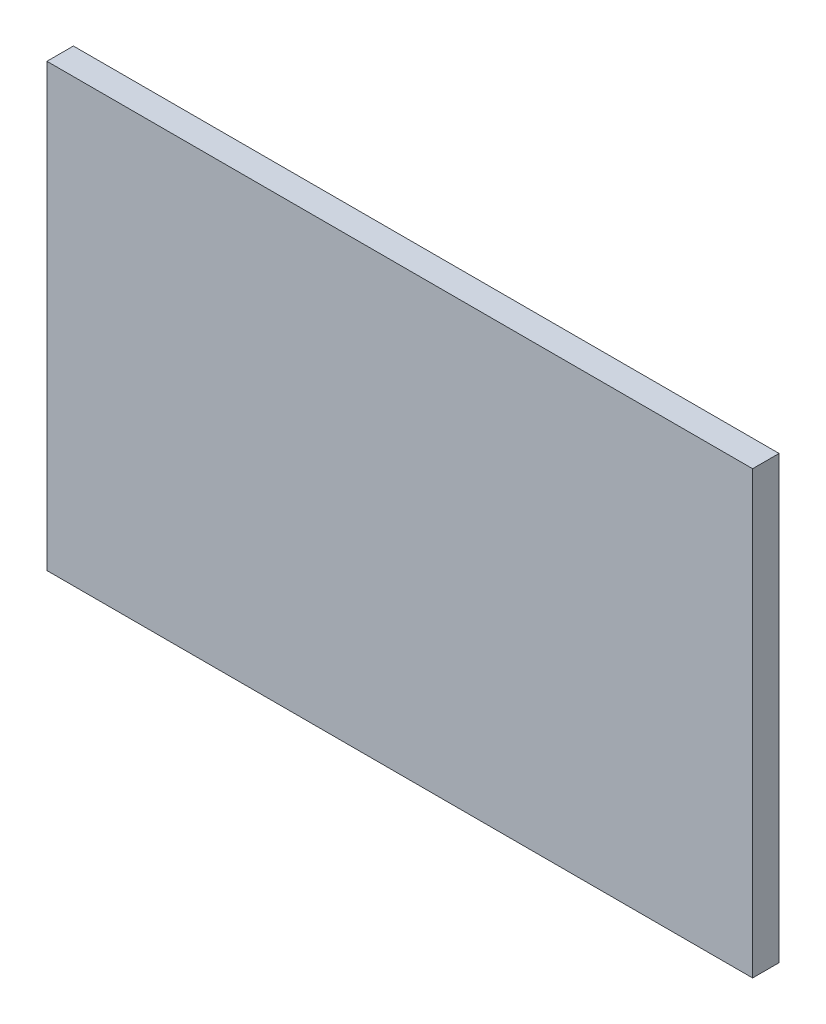
from build123d import *

# Parameters (mm, degrees)
SKETCH_1_W      = 80
SKETCH_1_H      = 50
EXTRUDE_1_DEPTH = 3


with BuildPart() as part:
    # 草图1 → 凸台-拉伸1 (new body)
    with BuildSketch(Plane.XY):
        with Locations((7.77607362, 3.485110734)):
            Rectangle(SKETCH_1_W, SKETCH_1_H)
    extrude(amount=EXTRUDE_1_DEPTH)


solid = part.part
